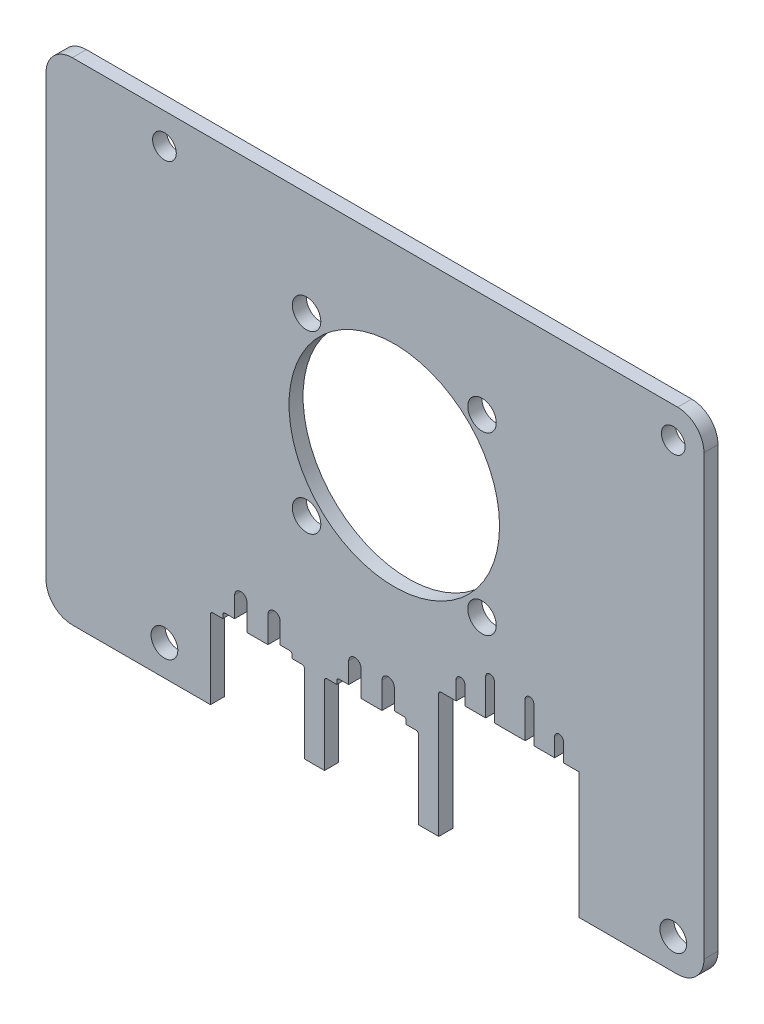
from build123d import *

# Parameters (mm, degrees)
SKETCH1_R           = 1.35
SKETCH1_R_2         = 1.524
BOSS_EXTRUDE1_DEPTH = 0.8
SKETCH2_R           = 1.625
SKETCH2_R_2         = 12
CUT_EXTRUDE1_DEPTH  = 51.919642575
BOSS_EXTRUDE2_DEPTH = 1.6
CUT_EXTRUDE2_DEPTH  = 60.521508717


with BuildPart() as part:
    # Sketch1 → Boss-Extrude1 (new, symmetric)
    with BuildSketch(Plane.XY):
        with BuildLine():
            Line((22.5, 25), (22.5, -25))
            ThreePointArc((22.5, -25), (21.621320344, -27.121320344), (19.5, -28))
            Line((19.5, -28), (-39.5, -28))
            ThreePointArc((-39.5, -28), (-41.621320344, -27.121320344), (-42.5, -25))
            Line((-42.5, -25), (-42.5, 25))
            ThreePointArc((-42.5, 25), (-41.621320344, 27.121320344), (-39.5, 28))
            Line((-39.5, 28), (19.5, 28))
            ThreePointArc((19.5, 28), (21.621320344, 27.121320344), (22.5, 25))
        make_face()
        with Locations((-39, 24.5)):
            Circle(SKETCH1_R, mode=Mode.SUBTRACT)
        with Locations((-39, -24.5)):
            Circle(SKETCH1_R_2, mode=Mode.SUBTRACT)
        with Locations((19, -24.5)):
            Circle(SKETCH1_R_2, mode=Mode.SUBTRACT)
        with Locations((19, 24.5)):
            Circle(SKETCH1_R, mode=Mode.SUBTRACT)
    extrude(amount=BOSS_EXTRUDE1_DEPTH, both=True)

    # Sketch2 → Cut-Extrude1 (cut, through all)
    with BuildSketch(Plane.XY.offset(0.8)):
        with Locations((-2.799944405, 16.10995525)):
            Circle(SKETCH2_R)
        with Locations((-22.799944405, 16.10995525)):
            Circle(SKETCH2_R)
        with Locations((-22.799944405, -3.89004475)):
            Circle(SKETCH2_R)
        with Locations((-2.799944405, -3.89004475)):
            Circle(SKETCH2_R)
        with Locations((-12.799944405, 6.10995525)):
            Circle(SKETCH2_R_2)
    extrude(amount=-CUT_EXTRUDE1_DEPTH, mode=Mode.SUBTRACT)

    # Sketch4 → Boss-Extrude2 (add)
    with BuildSketch(Plane.XY.offset(0.8)):
        with BuildLine():
            Line((-49.5, 28), (-39.5, 28))
            ThreePointArc((-39.5, 28), (-41.621320344, 27.121320344), (-42.5, 25))
            Line((-42.5, 25), (-42.5, -25))
            ThreePointArc((-42.5, -25), (-41.621320344, -27.121320344), (-39.5, -28))
            Line((-39.5, -28), (-49.5, -28))
            ThreePointArc((-49.5, -28), (-51.621320344, -27.121320344), (-52.5, -25))
            Line((-52.5, -25), (-52.5, 25))
            ThreePointArc((-52.5, 25), (-51.621320344, 27.121320344), (-49.5, 28))
        make_face()
    extrude(amount=-BOSS_EXTRUDE2_DEPTH)

    # Sketch5 → Cut-Extrude2 (cut, through all)
    with BuildSketch(Plane.XY.offset(0.8)):
        with BuildLine():
            Line((-27.2, -18.8), (-29.6, -18.8))
            Line((-29.6, -18.8), (-29.6, -15.8))
            ThreePointArc((-29.6, -15.8), (-30.3, -15.1), (-31, -15.8))
            Line((-31, -15.8), (-31, -18.14))
            Line((-31, -18.14), (-32.1, -18.14))
            ThreePointArc((-32.1, -18.14), (-32.276776695, -18.213223305), (-32.35, -18.39))
            Line((-32.35, -18.39), (-32.35, -18.8))
            Line((-32.35, -18.8), (-33.5, -18.8))
            ThreePointArc((-33.5, -18.8), (-33.676776695, -18.873223305), (-33.75, -19.05))
            Line((-33.75, -19.05), (-33.75, -28))
            Line((-33.75, -28), (-23.05, -28))
            Line((-23.05, -28), (-23.05, -19.05))
            ThreePointArc((-23.05, -19.05), (-23.123223305, -18.873223305), (-23.3, -18.8))
            Line((-23.3, -18.8), (-24.45, -18.8))
            Line((-24.45, -18.8), (-24.45, -18.39))
            ThreePointArc((-24.45, -18.39), (-24.523223305, -18.213223305), (-24.7, -18.14))
            Line((-24.7, -18.14), (-25.8, -18.14))
            Line((-25.8, -18.14), (-25.8, -15.8))
            ThreePointArc((-25.8, -15.8), (-26.5, -15.1), (-27.2, -15.8))
            Line((-27.2, -15.8), (-27.2, -18.8))
        make_face()
        with BuildLine():
            Line((-14.2, -18.8), (-16.6, -18.8))
            Line((-16.6, -18.8), (-16.6, -15.8))
            ThreePointArc((-16.6, -15.8), (-17.3, -15.1), (-18, -15.8))
            Line((-18, -15.8), (-18, -18.14))
            Line((-18, -18.14), (-19.1, -18.14))
            ThreePointArc((-19.1, -18.14), (-19.276776695, -18.213223305), (-19.35, -18.39))
            Line((-19.35, -18.39), (-19.35, -18.8))
            Line((-19.35, -18.8), (-20.5, -18.8))
            ThreePointArc((-20.5, -18.8), (-20.676776695, -18.873223305), (-20.75, -19.05))
            Line((-20.75, -19.05), (-20.75, -28))
            Line((-20.75, -28), (-10.05, -28))
            Line((-10.05, -28), (-10.05, -19.05))
            ThreePointArc((-10.05, -19.05), (-10.123223305, -18.873223305), (-10.3, -18.8))
            Line((-10.3, -18.8), (-11.45, -18.8))
            Line((-11.45, -18.8), (-11.45, -18.39))
            ThreePointArc((-11.45, -18.39), (-11.523223305, -18.213223305), (-11.7, -18.14))
            Line((-11.7, -18.14), (-12.8, -18.14))
            Line((-12.8, -18.14), (-12.8, -15.8))
            ThreePointArc((-12.8, -15.8), (-13.5, -15.1), (-14.2, -15.8))
            Line((-14.2, -15.8), (-14.2, -18.8))
        make_face()
        with BuildLine():
            Line((-2.3825, -9.525), (-2.3825, -13.625))
            Line((-2.3825, -13.625), (-4.7475, -13.625))
            Line((-4.7475, -13.625), (-4.7475, -11.525))
            ThreePointArc((-4.7475, -11.525), (-5.2475, -11.025), (-5.7475, -11.525))
            Line((-5.7475, -11.525), (-5.7475, -13.625))
            Line((-5.7475, -13.625), (-7.4825, -13.625))
            ThreePointArc((-7.4825, -13.625), (-7.659276695, -13.698223305), (-7.7325, -13.875))
            Line((-7.7325, -13.875), (-7.7325, -28))
            Line((-7.7325, -28), (-7.426776695, -28))
            Line((-7.426776695, -28), (8.235, -28))
            Line((8.235, -28), (8.235, -13.625613252))
            ThreePointArc((8.235, -13.625613252), (8.226255371, -13.62515336), (8.2175, -13.625))
            Line((8.2175, -13.625), (6.4825, -13.625))
            Line((6.4825, -13.625), (6.4825, -11.525))
            ThreePointArc((6.4825, -11.525), (5.9825, -11.025), (5.4825, -11.525))
            Line((5.4825, -11.525), (5.4825, -13.625))
            Line((5.4825, -13.625), (3.1175, -13.625))
            Line((3.1175, -13.625), (3.1175, -9.525))
            ThreePointArc((3.1175, -9.525), (2.6175, -9.025), (2.1175, -9.525))
            Line((2.1175, -9.525), (2.1175, -13.625))
            Line((2.1175, -13.625), (-1.3825, -13.625))
            Line((-1.3825, -13.625), (-1.3825, -9.525))
            ThreePointArc((-1.3825, -9.525), (-1.8825, -9.025), (-2.3825, -9.525))
        make_face()
    extrude(amount=-CUT_EXTRUDE2_DEPTH, mode=Mode.SUBTRACT)


solid = part.part
